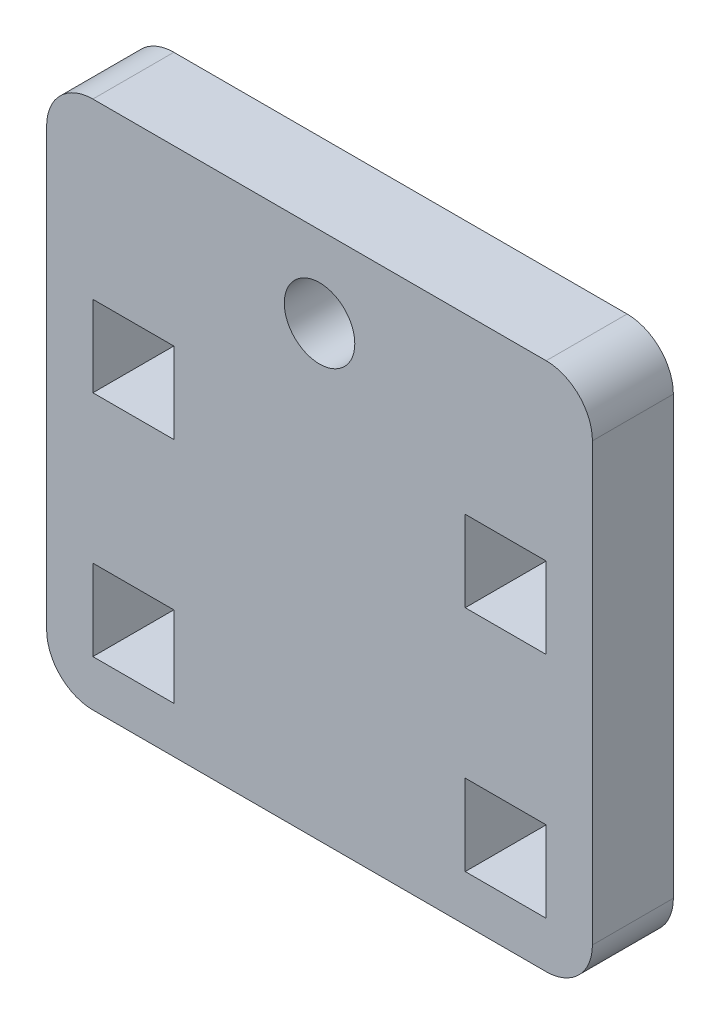
from build123d import *

# Parameters (mm, degrees)
SKETCH1_W           = 23.6
SKETCH1_H           = 22.88
SKETCH1_R           = 1.525
SKETCH1_W_2         = 3.5
SKETCH1_H_2         = 3.5
BOSS_EXTRUDE1_DEPTH = 3.5
FILLET1_R           = 2


with BuildPart() as part:
    # Sketch1 → Boss-Extrude1 (new body)
    with BuildSketch(Plane.XY):
        with Locations((0, 11.44)):
            Rectangle(SKETCH1_W, SKETCH1_H)
        with Locations((0, 19.38)):
            Circle(SKETCH1_R, mode=Mode.SUBTRACT)
        with Locations((-8.05, 3.75)):
            Rectangle(SKETCH1_W_2, SKETCH1_H_2, mode=Mode.SUBTRACT)
        with Locations((8.05, 3.75)):
            Rectangle(SKETCH1_W_2, SKETCH1_H_2, mode=Mode.SUBTRACT)
        with Locations((8.05, 13.63)):
            Rectangle(SKETCH1_W_2, SKETCH1_H_2, mode=Mode.SUBTRACT)
        with Locations((-8.05, 13.63)):
            Rectangle(SKETCH1_W_2, SKETCH1_H_2, mode=Mode.SUBTRACT)
    extrude(amount=BOSS_EXTRUDE1_DEPTH)

    # Fillet1
    fillet1_edges = [part.edges().sort_by_distance(p)[0] for p in [
        (-11.8, 22.88, 1.75),
        (11.8, 22.88, 1.75),
        (11.8, 0, 1.75),
        (-11.8, 0, 1.75),
    ]]
    fillet(fillet1_edges, radius=FILLET1_R)


solid = part.part
